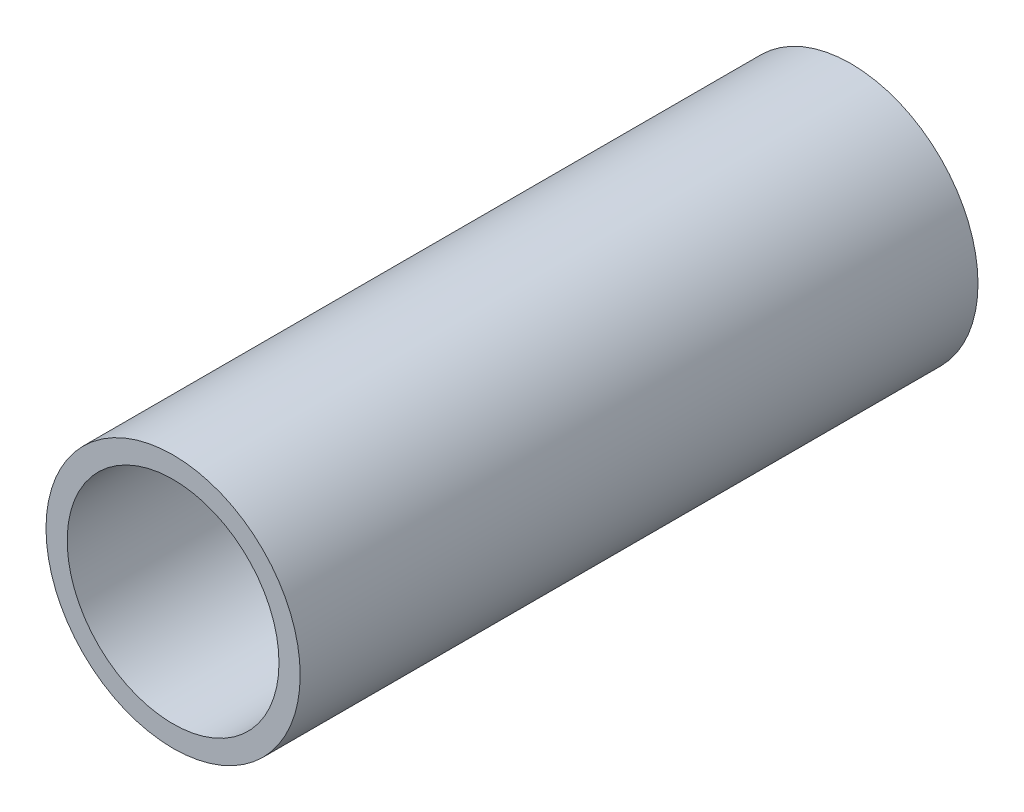
from build123d import *

# Parameters (mm, degrees)
SKETCH1_R           = 38.1
SKETCH1_R_2         = 31.75
EXTRUDE_THIN1_DEPTH = 203.2


with BuildPart() as part:
    # Sketch1 → Extrude-Thin1 (new body)
    with BuildSketch(Plane.XY):
        Circle(SKETCH1_R)
        Circle(SKETCH1_R_2, mode=Mode.SUBTRACT)
    extrude(amount=EXTRUDE_THIN1_DEPTH)


solid = part.part
